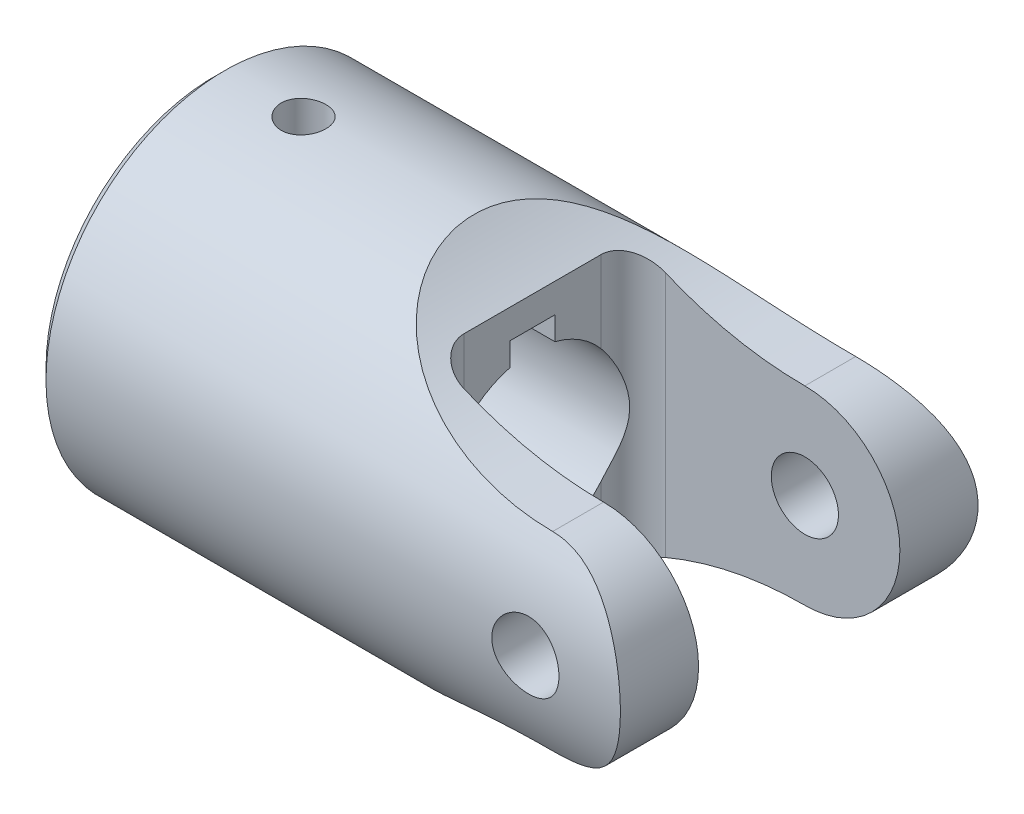
from build123d import *

# Parameters (mm, degrees)
SKETCH1_R               = 25.4
BOSS_EXTRUDE1_DEPTH     = 83.08975
CUT_EXTRUDE1_DEPTH      = 43.688
SKETCH5_R               = 4.76885
CUT_EXTRUDE2_DEPTH      = 43.688
CUT_EXTRUDE3_DEPTH      = 43.688
CUT_EXTRUDE4_DEPTH      = 87.376
CUT_EXTRUDE4_DEPTH_BACK = 58.744653114
CHAMFER1_SIZE           = 1.524
SKETCH9_R               = 3.175
CUT_EXTRUDE5_DEPTH      = 91.521967399


with BuildPart() as part:
    # Sketch1 → Boss-Extrude1 (new body)
    with BuildSketch(Plane(origin=(0, 0, 0), x_dir=(0, 0, -1), z_dir=(1, 0, 0))):
        Circle(SKETCH1_R)
    extrude(amount=BOSS_EXTRUDE1_DEPTH)

    # Sketch4 → Cut-Extrude1 (cut, symmetric)
    with BuildSketch(Plane.XY):
        with BuildLine():
            Line((36.9170127, -25.4), (83.08975, -25.4))
            Line((83.08975, -25.4), (83.08975, 0))
            ThreePointArc((83.08975, 0), (79.137522129, -9.541522129), (69.596, -13.49375))
            ThreePointArc((69.596, -13.49375), (52.205808799, -16.563033999), (36.9170127, -25.4))
        make_face()
        with BuildLine():
            ThreePointArc((69.596, 13.49375), (79.137522129, 9.541522129), (83.08975, 0))
            Line((83.08975, 0), (83.08975, 25.4))
            Line((83.08975, 25.4), (36.9170127, 25.4))
            ThreePointArc((36.9170127, 25.4), (52.205808799, 16.563033999), (69.596, 13.49375))
        make_face()
    extrude(amount=CUT_EXTRUDE1_DEPTH, both=True, mode=Mode.SUBTRACT)

    # Sketch5 → Cut-Extrude2 (cut, symmetric)
    with BuildSketch(Plane.XY):
        with Locations((69.596, 0)):
            Circle(SKETCH5_R)
    extrude(amount=CUT_EXTRUDE2_DEPTH, both=True, mode=Mode.SUBTRACT)

    # Sketch6 → Cut-Extrude3 (cut, symmetric)
    with BuildSketch(Plane(origin=(0, 0, 0), x_dir=(1, 0, 0), z_dir=(0, 1, 0))):
        with BuildLine():
            Line((83.08975, 14.29385), (49.784, 14.29385))
            ThreePointArc((49.784, 14.29385), (46.551107796, 12.954742204), (45.212, 9.72185))
            Line((45.212, 9.72185), (45.212, -9.72185))
            ThreePointArc((45.212, -9.72185), (46.551107796, -12.954742204), (49.784, -14.29385))
            Line((49.784, -14.29385), (83.08975, -14.29385))
            Line((83.08975, -14.29385), (83.08975, 14.29385))
        make_face()
    extrude(amount=CUT_EXTRUDE3_DEPTH, both=True, mode=Mode.SUBTRACT)

    # Sketch7 → Cut-Extrude4 (cut, two sides: drawn at the far end of the back side and taken through both)
    with BuildSketch(Plane(origin=(45.212, 0, 0), x_dir=(0, 0, -1), z_dir=(1, 0, 0)).offset(-CUT_EXTRUDE4_DEPTH_BACK)):
        with BuildLine():
            Line((-3.175, 12.296722124), (-3.175, 15.5956))
            Line((-3.175, 15.5956), (3.175, 15.5956))
            Line((3.175, 15.5956), (3.175, 12.296722124))
            ThreePointArc((3.175, 12.296722124), (0, -12.7), (-3.175, 12.296722124))
        make_face()
    extrude(amount=CUT_EXTRUDE4_DEPTH + CUT_EXTRUDE4_DEPTH_BACK, mode=Mode.SUBTRACT)

    # Chamfer1
    chamfer1_edges = [part.edges().sort_by_distance(p)[0] for p in [
        (0, 0, 25.4),
    ]]
    chamfer(chamfer1_edges, length=CHAMFER1_SIZE)

    # Sketch9 → Cut-Extrude5 (cut, through all)
    with BuildSketch(Plane(origin=(0, 0, 0), x_dir=(1, 0, 0), z_dir=(0, 1, 0))):
        with Locations((12.7, 0)):
            Circle(SKETCH9_R)
    extrude(amount=CUT_EXTRUDE5_DEPTH, mode=Mode.SUBTRACT)


solid = part.part
